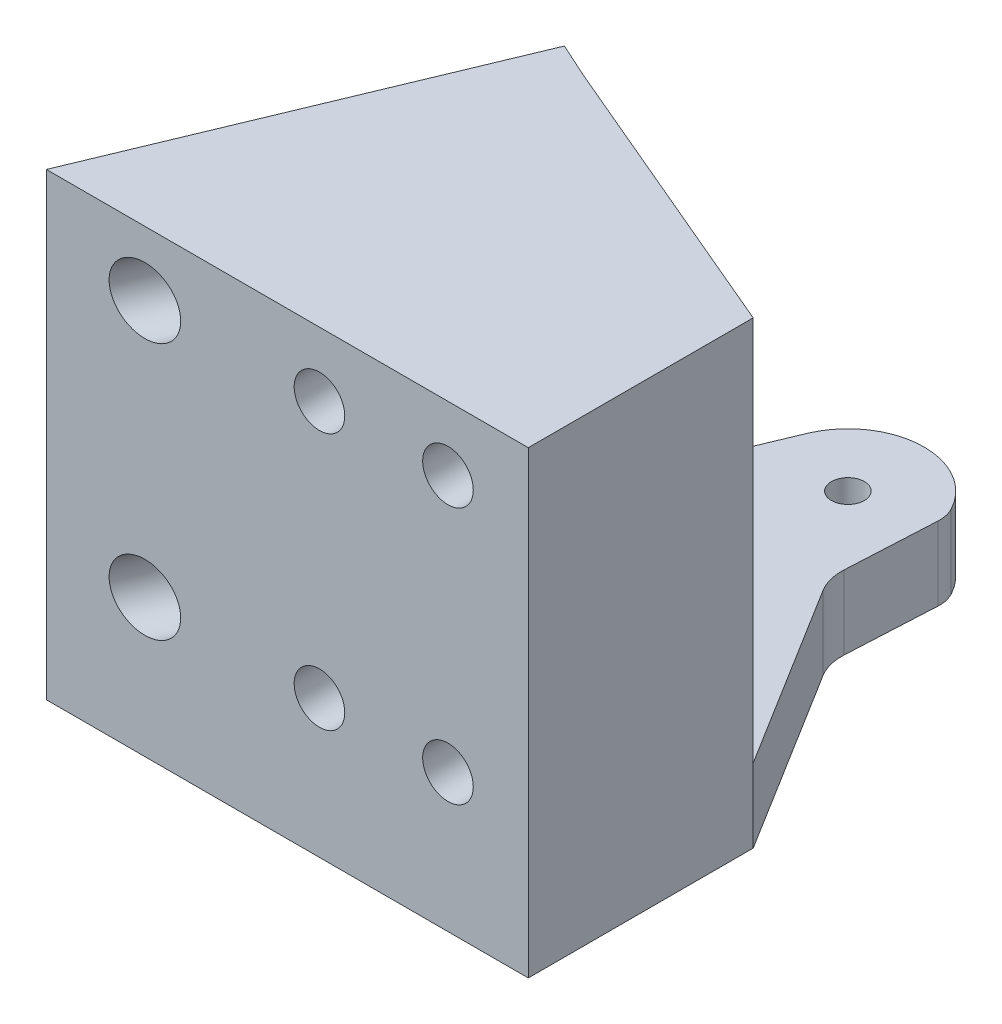
from build123d import *

# Parameters (mm, degrees)
BOSS_EXTRUDE1_DEPTH = 48
SKETCH4_R           = 3.15
SKETCH4_R_2         = 2
CUT_EXTRUDE2_DEPTH  = 4.7
SKETCH6_R           = 2.05
BOSS_EXTRUDE3_DEPTH = 9.18
SKETCH4_3_R         = 2
CUT_EXTRUDE3_DEPTH  = 8
FILLET3_R           = 4
FILLET4_R           = 6
BOSS_EXTRUDE4_DEPTH = 48
CUT_EXTRUDE6_START  = -5
SKETCH3_R           = 4.1
CUT_EXTRUDE6_DEPTH  = 66
SKETCH3_3_R         = 2.05
CUT_EXTRUDE7_DEPTH  = 7


with BuildPart() as part:
    # Sketch2 → Boss-Extrude1 (new body)
    with BuildSketch(Plane(origin=(0, 0, 0), x_dir=(1, 0, 0), z_dir=(0, 1, 0))):
        Polygon((0, 0), (0, -15.62924514), (0, -43.62924514), (36.820194138, -43.62924514), (36.820194138, -15.62924514), align=None)
    extrude(amount=BOSS_EXTRUDE1_DEPTH)

    # Sketch4 → Cut-Extrude2 (cut)
    # profile 1 of 8: a face of its own
    with BuildSketch(Plane.XY.offset(43.62924514)):
        with Locations((10.820194138, 40)):
            Circle(SKETCH4_R)
        with Locations((10.820194138, 40)):
            Circle(SKETCH4_R_2, mode=Mode.SUBTRACT)
    # profile 2 of 8: a face of its own
    with BuildSketch(Plane.XY.offset(43.62924514)):
        with Locations((10.820194138, 40)):
            Circle(SKETCH4_R_2)
    # profile 3 of 8: a face of its own
    with BuildSketch(Plane.XY.offset(43.62924514)):
        with Locations((26.820194138, 40)):
            Circle(SKETCH4_R)
        with Locations((26.820194138, 40)):
            Circle(SKETCH4_R_2, mode=Mode.SUBTRACT)
    # profile 4 of 8: a face of its own
    with BuildSketch(Plane.XY.offset(43.62924514)):
        with Locations((26.820194138, 40)):
            Circle(SKETCH4_R_2)
    # profile 5 of 8: a face of its own
    with BuildSketch(Plane.XY.offset(43.62924514)):
        with Locations((26.820194138, 8)):
            Circle(SKETCH4_R)
        with Locations((26.820194138, 8)):
            Circle(SKETCH4_R_2, mode=Mode.SUBTRACT)
    # profile 6 of 8: a face of its own
    with BuildSketch(Plane.XY.offset(43.62924514)):
        with Locations((26.820194138, 8)):
            Circle(SKETCH4_R_2)
    # profile 7 of 8: a face of its own
    with BuildSketch(Plane.XY.offset(43.62924514)):
        with Locations((10.820194138, 8)):
            Circle(SKETCH4_R)
        with Locations((10.820194138, 8)):
            Circle(SKETCH4_R_2, mode=Mode.SUBTRACT)
    # profile 8 of 8: a face of its own
    with BuildSketch(Plane.XY.offset(43.62924514)):
        with Locations((10.820194138, 8)):
            Circle(SKETCH4_R_2)
    extrude(amount=-CUT_EXTRUDE2_DEPTH, mode=Mode.SUBTRACT)

    # Sketch6 → Boss-Extrude3 (add)
    with BuildSketch(Plane.XZ):
        with BuildLine():
            Line((21.555608411, -8.941223432), (36.820194138, 15.62924514))
            Line((36.820194138, 15.62924514), (36.820194138, 43.62924514))
            Line((36.820194138, 43.62924514), (-23.179805862, 43.62924514))
            Line((-23.179805862, 43.62924514), (4.617828, -23.236779181))
            ThreePointArc((4.617828, -23.236779181), (13.54895559, -29.088670071), (22.279280146, -22.941223432))
            Line((22.279280146, -22.941223432), (21.555608411, -8.941223432))
        make_face()
        with Locations(Location((13.39, -19.59, 0), (0, 0, 270))):
            Circle(SKETCH6_R, mode=Mode.SUBTRACT)
    extrude(amount=BOSS_EXTRUDE3_DEPTH)

    # Sketch4<3> → Cut-Extrude3 (cut)
    with BuildSketch(Plane.XY.offset(43.62924514)):
        with Locations((10.820194138, 40)):
            Circle(SKETCH4_3_R)
        with Locations((26.820194138, 40)):
            Circle(SKETCH4_3_R)
        with Locations((26.820194138, 8)):
            Circle(SKETCH4_3_R)
        with Locations((10.820194138, 8)):
            Circle(SKETCH4_3_R)
    extrude(amount=-CUT_EXTRUDE3_DEPTH, mode=Mode.SUBTRACT)

    # Fillet3
    fillet3_edges = [part.edges().sort_by_distance(p)[0] for p in [
        (22.279280146, -4.59, -22.941223432),
    ]]
    fillet(fillet3_edges, radius=FILLET3_R)

    # Fillet4
    fillet4_edges = [part.edges().sort_by_distance(p)[0] for p in [
        (21.555608411, -4.59, -8.941223432),
    ]]
    fillet(fillet4_edges, radius=FILLET4_R)

    # Sketch6<3> → Boss-Extrude4 (add)
    with BuildSketch(Plane.XZ):
        Polygon((-23.179805862, 43.62924514), (0, 0), (0, 43.62924514), align=None)
        Polygon((-4.239616227, -1.930574343), (0, 0), (-23.179805862, 43.62924514), align=None)
    extrude(amount=-BOSS_EXTRUDE4_DEPTH)

    # Sketch3 → Cut-Extrude6 (cut)
    with BuildSketch(Plane(origin=(0, 0, 0), x_dir=(-0.9205048534524429, 0, -0.3907311284892679), z_dir=(0.3907311284892679, 0, -0.9205048534524429)).offset(CUT_EXTRUDE6_START)):
        with Locations((-7, 40)):
            Circle(SKETCH3_R)
        with Locations((-7, 8)):
            Circle(SKETCH3_R)
    extrude(amount=-CUT_EXTRUDE6_DEPTH, mode=Mode.SUBTRACT)

    # Sketch3<3> → Cut-Extrude7 (cut)
    with BuildSketch(Plane(origin=(0, 0, 0), x_dir=(-0.9205048534524429, 0, -0.3907311284892679), z_dir=(0.3907311284892679, 0, -0.9205048534524429))):
        with Locations((-7, 40)):
            Circle(SKETCH3_3_R)
        with Locations((-7, 8)):
            Circle(SKETCH3_3_R)
    extrude(amount=-CUT_EXTRUDE7_DEPTH, mode=Mode.SUBTRACT)


solid = part.part
